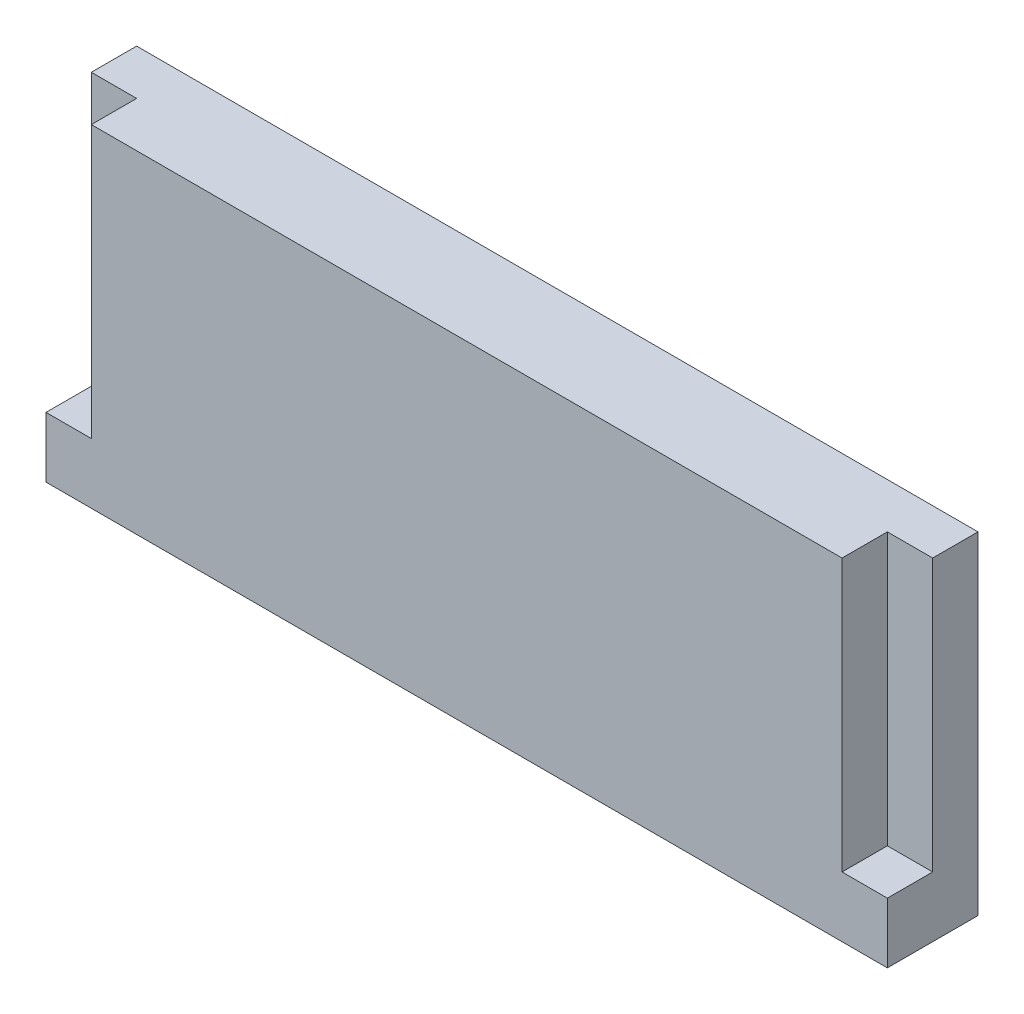
from build123d import *

# Parameters (mm, degrees)
EXTRUDE_1_DEPTH = 18
SKETCH_2_W      = 55.7
SKETCH_2_H      = 6
EXTRUDE_2_DEPTH = 4


with BuildPart() as part:
    # 草图1 → 凸台-拉伸1 (new body)
    with BuildSketch(Plane(origin=(0, 0, 0), x_dir=(1, 0, 0), z_dir=(0, 1, 0))):
        Polygon((0, 0), (3, 0), (3, -3), (52.7, -3), (52.7, 0), (55.7, 0), (55.7, 3), (0, 3), align=None)
    extrude(amount=EXTRUDE_1_DEPTH)

    # 草图2 → 凸台-拉伸2 (add)
    with BuildSketch(Plane.XZ):
        with Locations((27.85, 0)):
            Rectangle(SKETCH_2_W, SKETCH_2_H)
    extrude(amount=EXTRUDE_2_DEPTH)


solid = part.part
